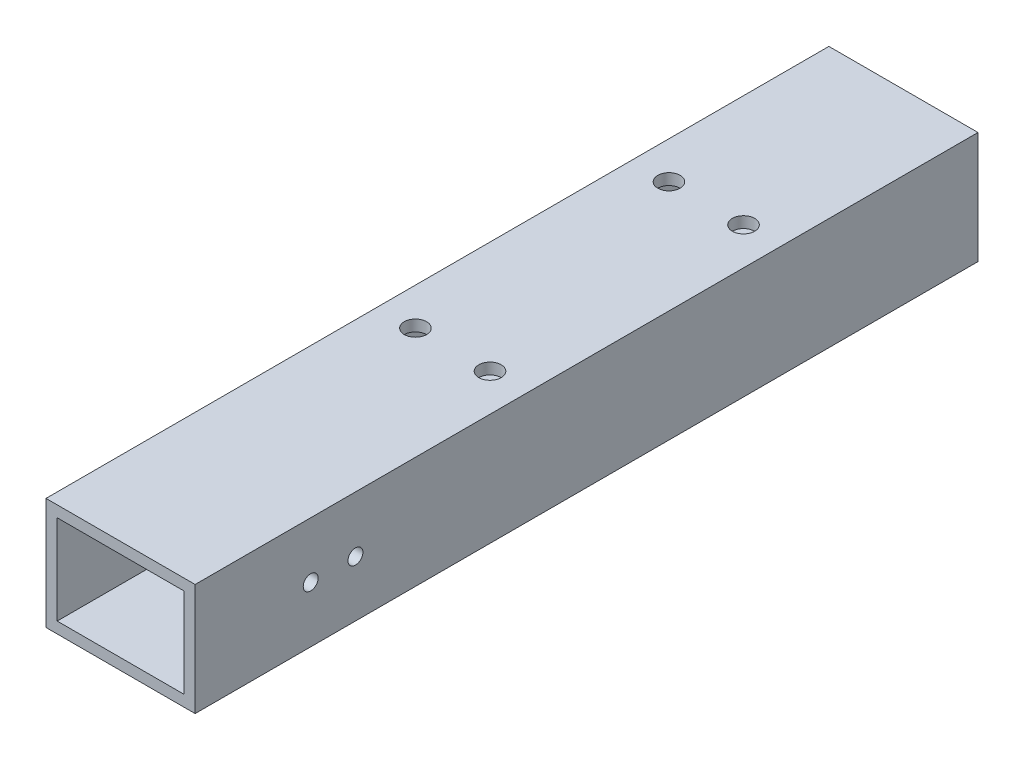
from build123d import *

# Parameters (mm, degrees)
SKETCH_1_W          = 40
SKETCH_1_H          = 30
SKETCH_1_W_2        = 34
SKETCH_1_H_2        = 24
EXTRUDE_1_DEPTH     = 210
SKETCH_2_R          = 2
CUT_EXTRUDE_1_DEPTH = 216.870331449
SKETCH_3_R          = 3
CUT_EXTRUDE_2_DEPTH = 216.870331449


with BuildPart() as part:
    # 草图1 → 凸台-拉伸1 (new body)
    with BuildSketch(Plane.XY):
        with Locations((20, 15)):
            Rectangle(SKETCH_1_W, SKETCH_1_H)
        with Locations((20, 15)):
            Rectangle(SKETCH_1_W_2, SKETCH_1_H_2, mode=Mode.SUBTRACT)
    extrude(amount=EXTRUDE_1_DEPTH)

    # 草图2 → 切除-拉伸1 (cut, through all)
    with BuildSketch(Plane(origin=(0, 0, 0), x_dir=(0, 0, -1), z_dir=(1, 0, 0))):
        with Locations(Location((-167, 15, 0), (0, 0, 180))):
            Circle(SKETCH_2_R)
        with Locations(Location((-179, 15, 0), (0, 0, 180))):
            Circle(SKETCH_2_R)
    extrude(amount=CUT_EXTRUDE_1_DEPTH, mode=Mode.SUBTRACT)

    # 草图3 → 切除-拉伸2 (cut, through all)
    with BuildSketch(Plane(origin=(0, 0, 0), x_dir=(1, 0, 0), z_dir=(0, 1, 0))):
        with Locations(Location((10, -52.9, 0), (0, 0, 90))):
            Circle(SKETCH_3_R)
        with Locations(Location((30, -52.9, 0), (0, 0, 90))):
            Circle(SKETCH_3_R)
        with Locations(Location((30, -120.9, 0), (0, 0, 90))):
            Circle(SKETCH_3_R)
        with Locations(Location((10, -120.9, 0), (0, 0, 90))):
            Circle(SKETCH_3_R)
    extrude(amount=CUT_EXTRUDE_2_DEPTH, mode=Mode.SUBTRACT)


solid = part.part
